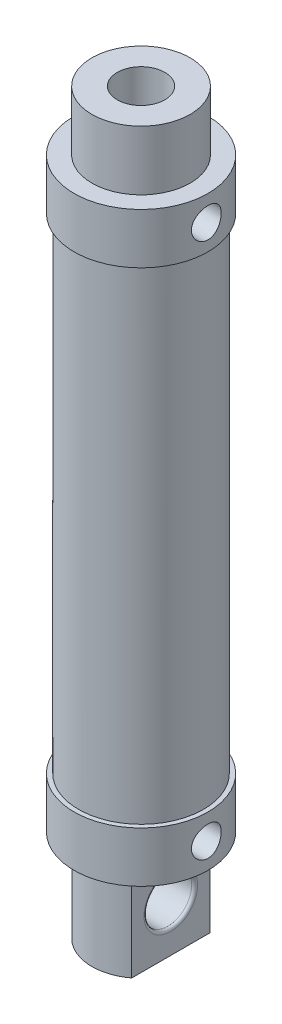
from build123d import *

# Parameters (mm, degrees)
SKETCH_1_R          = 21
SKETCH_1_R_2        = 17.5
EXTRUDE_1_DEPTH     = 163
SKETCH_2_R          = 22.5
EXTRUDE_2_DEPTH     = 17
SKETCH_4_R          = 5
CUT_EXTRUDE_3_DEPTH = 17
EXTRUDE_4_DEPTH     = 31
SKETCH_6_R          = 8
CUT_EXTRUDE_5_DEPTH = 31
FILLET_1_R          = 1
EXTRUDE_START       = 20
SKETCH_7_R          = 16.5
EXTRUDE_6_DEPTH     = 20
CUT_EXTRUDE_9_REACH = 252.033
SKETCH_8_R          = 8


with BuildPart() as part:
    # 草图1 → 拉伸1 (new body)
    with BuildSketch(Plane(origin=(0, 0, 0), x_dir=(1, 0, 0), z_dir=(0, 1, 0))):
        with Locations(Location((0, 0, 0), (0, 0, 270))):
            Circle(SKETCH_1_R)
        with Locations(Location((0, 0, 0), (0, 0, 270))):
            Circle(SKETCH_1_R_2, mode=Mode.SUBTRACT)
    extrude(amount=EXTRUDE_1_DEPTH)

    # 草图2 → 拉伸2 (add)
    with BuildSketch(Plane.XZ):
        with Locations(Location((0, 0, 0), (0, 0, 270))):
            Circle(SKETCH_2_R)
    extrude_2 = extrude(amount=EXTRUDE_2_DEPTH)

    # 草图4 → 拉伸3 (cut)
    with BuildSketch(Plane(origin=(22.5, 0, 0), x_dir=(0, 0, -1), z_dir=(1, 0, 0))):
        with Locations((0, -8.5)):
            Circle(SKETCH_4_R)
    cut_extrude_3 = extrude(amount=-CUT_EXTRUDE_3_DEPTH, mode=Mode.SUBTRACT)

    # 镜向1: 拉伸2, 拉伸3 across plane
    add(extrude_2.mirror(Plane.ZX.offset(81.5)))
    add(cut_extrude_3.mirror(Plane.ZX.offset(81.5)), mode=Mode.SUBTRACT)

    # 草图5 → 拉伸4 (add)
    with BuildSketch(Plane.XZ.offset(17)):
        with BuildLine():
            Line((10, -13.124404748), (10, 13.124404748))
            ThreePointArc((10, 13.124404748), (0, 16.5), (-10, 13.124404748))
            Line((-10, 13.124404748), (-10, -13.124404748))
            ThreePointArc((-10, -13.124404748), (0, -16.5), (10, -13.124404748))
        make_face()
    extrude(amount=EXTRUDE_4_DEPTH)

    # 草图6 → 拉伸5 (cut)
    with BuildSketch(Plane(origin=(10, 0, 0), x_dir=(0, 0, -1), z_dir=(1, 0, 0))):
        with Locations((0, -32)):
            Circle(SKETCH_6_R)
    extrude(amount=-CUT_EXTRUDE_5_DEPTH, mode=Mode.SUBTRACT)

    # 圆角1
    fillet_1_edges = [part.edges().sort_by_distance(p)[0] for p in [
        (-10, -32, 8),
        (10, -32, 8),
    ]]
    fillet(fillet_1_edges, radius=FILLET_1_R)

    # 草图7 → 拉伸6 (add)
    with BuildSketch(Plane(origin=(0, 180, 0), x_dir=(1, 0, 0), z_dir=(0, 1, 0)).offset(EXTRUDE_START)):
        with Locations(Location((0, 0, 0), (0, 0, 270))):
            Circle(SKETCH_7_R)
    extrude(amount=-EXTRUDE_6_DEPTH)

    # 草图8 → 拉伸9 (cut, up to next)
    with BuildSketch(Plane(origin=(0, 200, 0), x_dir=(1, 0, 0), z_dir=(0, 1, 0)), mode=Mode.PRIVATE) as cut_extrude_9_sk1:
        with Locations(Location((0, 0, 0), (0, 0, 270))):
            Circle(SKETCH_8_R)
    cut_extrude_9_tool1 = extrude(cut_extrude_9_sk1.sketch, amount=-CUT_EXTRUDE_9_REACH, mode=Mode.PRIVATE) & part.part
    add(cut_extrude_9_tool1.solids().sort_by_distance((0, 200, 0))[0], mode=Mode.SUBTRACT)


solid = part.part
